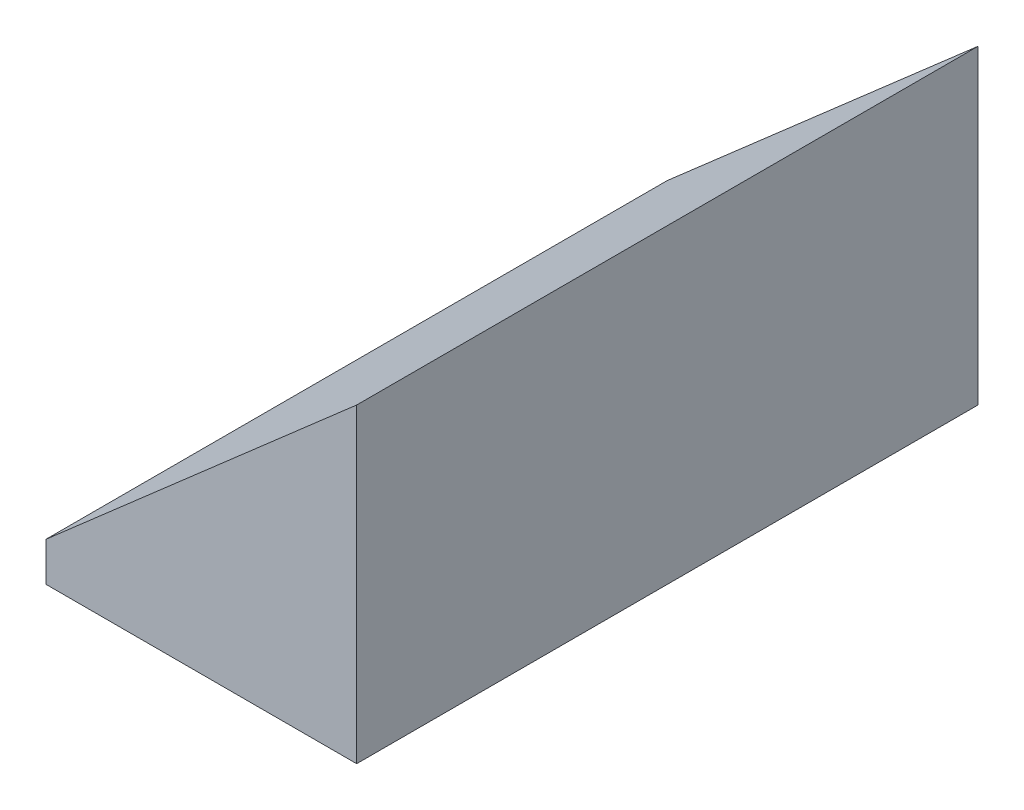
from build123d import *

# Parameters (mm, degrees)
BOSS_EXTRUDE1_DEPTH = 15.9
SHELL1_T            = -0.3
BOSS_EXTRUDE2_REACH = 21.473
SKETCH2_R           = 1.5
SKETCH2_R_2         = 0.5


with BuildPart() as part:
    # Sketch1 → Boss-Extrude1 (new body)
    with BuildSketch(Plane.XY):
        Polygon((0, 0), (0, 7.95), (-7.95, 1), (-7.95, 0), align=None)
    extrude(amount=-BOSS_EXTRUDE1_DEPTH)

    # Shell1
    shell1_openings = [part.faces().sort_by_distance(p)[0] for p in [
        (-3.975, 0, -7.95),
    ]]
    offset(amount=SHELL1_T, openings=shell1_openings, kind=Kind.INTERSECTION)

    # Boss-Extrude2: up to this plane
    boss_extrude2_end = Plane(origin=(-7.752549204, 0.774139018, -15.9), z_dir=(-0.6581693191022402, 0.7528699405557999, 0))
    # Sketch2 → Boss-Extrude2 (add, up to the surface)
    with BuildSketch(Plane(origin=(0, 0, 0), x_dir=(1, 0, 0), z_dir=(0, 1, 0)), mode=Mode.PRIVATE) as boss_extrude2_sk1:
        with Locations(Location((-3.975, 7.95, 0), (0, 0, 180))):
            Circle(SKETCH2_R)
        with Locations(Location((-3.975, 7.95, 0), (0, 0, 180))):
            Circle(SKETCH2_R_2, mode=Mode.SUBTRACT)
    boss_extrude2_tool1 = split(extrude(boss_extrude2_sk1.sketch, amount=BOSS_EXTRUDE2_REACH, mode=Mode.PRIVATE), bisect_by=boss_extrude2_end, keep=Keep.BOTH, mode=Mode.PRIVATE)
    add(boss_extrude2_tool1.solids().sort_by_distance((-2.517426, 0, -7.95))[0])


solid = part.part
